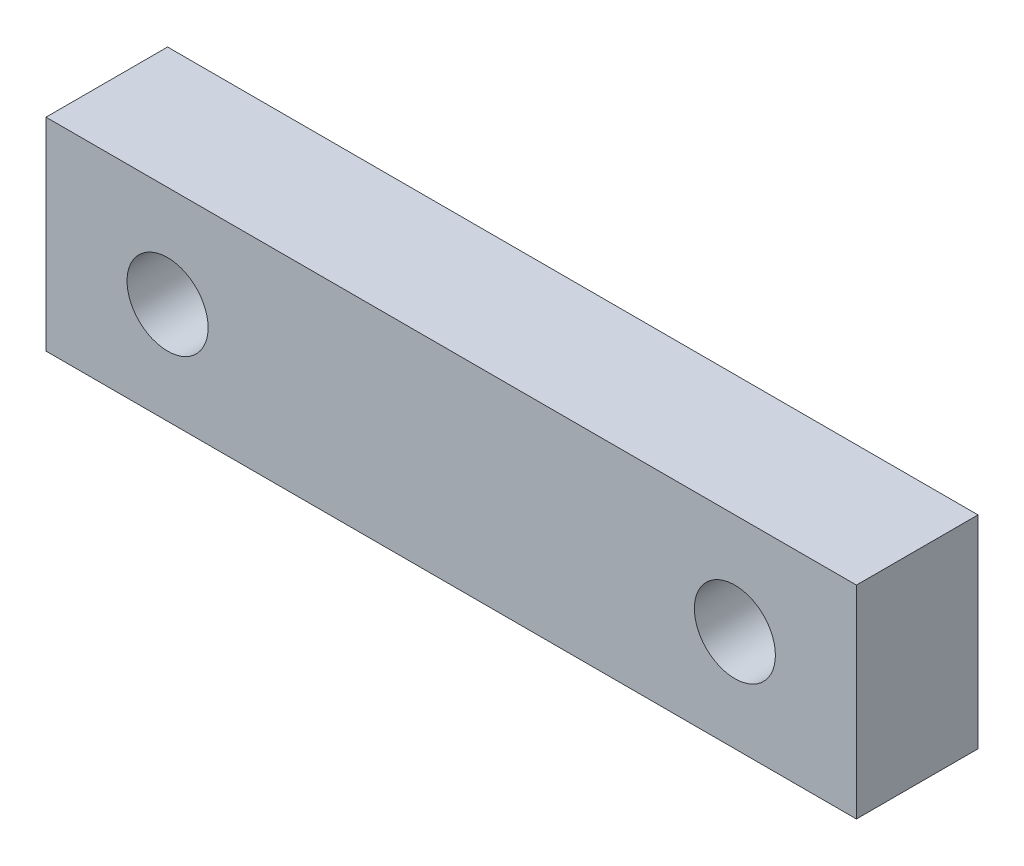
from build123d import *

# Parameters (mm, degrees)
SKETCH1_W           = 20
SKETCH1_H           = 5
SKETCH1_R           = 1
BOSS_EXTRUDE1_DEPTH = 3


with BuildPart() as part:
    # Sketch1 → Boss-Extrude1 (new body)
    with BuildSketch(Plane.XY):
        with Locations((-84.651749264, 16.541269871)):
            Rectangle(SKETCH1_W, SKETCH1_H)
        with Locations((-91.651749264, 16.541269871)):
            Circle(SKETCH1_R, mode=Mode.SUBTRACT)
        with Locations((-77.651749264, 16.541269871)):
            Circle(SKETCH1_R, mode=Mode.SUBTRACT)
    extrude(amount=BOSS_EXTRUDE1_DEPTH)


solid = part.part
